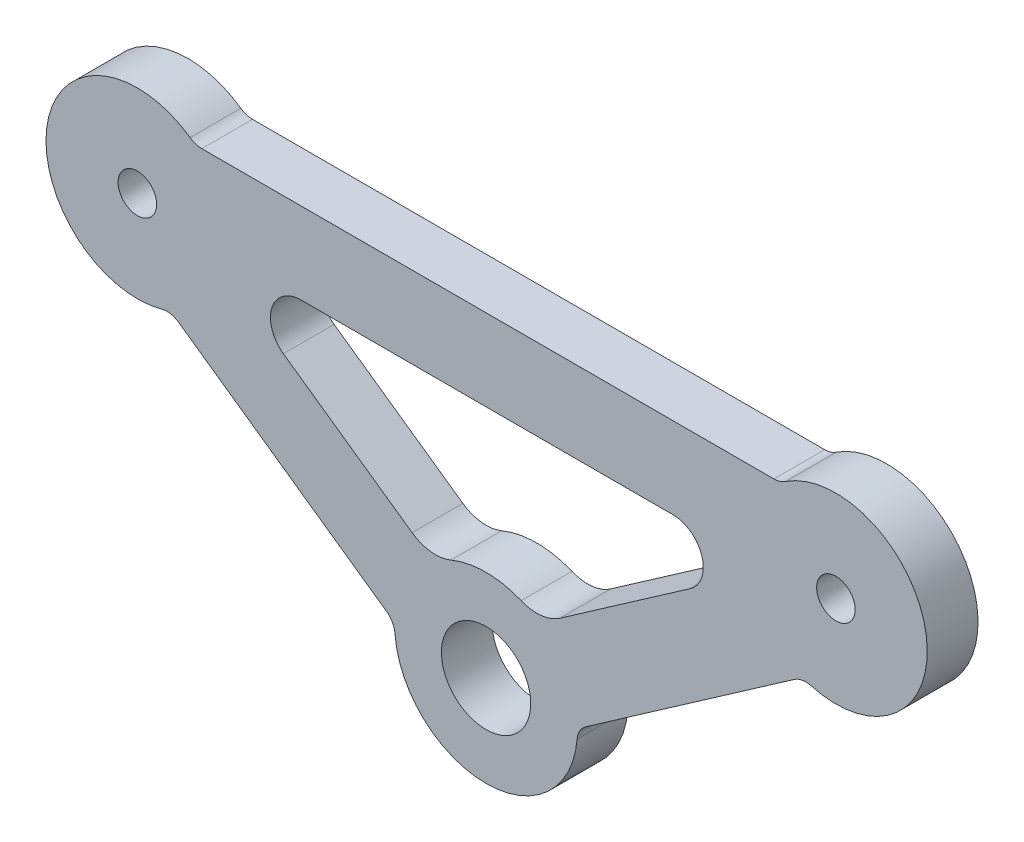
from build123d import *

# Parameters (mm, degrees)
ESQUISSE1_R        = 1.9
ESQUISSE1_R_2      = 4.4
BOSS_EXTRU_1_DEPTH = 5


with BuildPart() as part:
    # Esquisse1 → Boss.-Extru.1 (new body)
    with BuildSketch(Plane.XY):
        with BuildLine():
            Line((30.300082727, 2.968924298), (9.763004104, -11.338457247))
            ThreePointArc((9.763004104, -11.338457247), (9.172405802, -11.982601165), (8.912853429, -12.817083223))
            ThreePointArc((8.912853429, -12.817083223), (-0.078877501, -21.086221809), (-9.031083885, -12.77430994))
            ThreePointArc((-9.031083885, -12.77430994), (-9.286654991, -11.938599972), (-9.874175684, -11.291647751))
            Line((-9.874175684, -11.291647751), (-30.342811787, 3.113479848))
            ThreePointArc((-30.342811787, 3.113479848), (-31.150105491, 3.448150462), (-32.023034153, 3.406640278))
            ThreePointArc((-32.023034153, 3.406640278), (-43.269038369, 13.640318644), (-29.212114116, 19.437185406))
            ThreePointArc((-29.212114116, 19.437185406), (-28.66359268, 19.164598239), (-28.058297671, 19.070803357))
            Line((-28.058297671, 19.070803357), (28.299854, 19.070803357))
            ThreePointArc((28.299854, 19.070803357), (28.91331959, 19.167212023), (29.467641782, 19.447143388))
            ThreePointArc((29.467641782, 19.447143388), (43.297743059, 13.302630265), (31.981683615, 3.25407109))
            ThreePointArc((31.981683615, 3.25407109), (31.108962768, 3.29974241), (30.300082727, 2.968924298))
        make_face()
        with Locations((-34.404288116, 12.085904623)):
            Circle(ESQUISSE1_R, mode=Mode.SUBTRACT)
        with Locations((34.404288116, 11.921884391)):
            Circle(ESQUISSE1_R, mode=Mode.SUBTRACT)
        with Locations((-0.057424101, -12.086247379)):
            Circle(ESQUISSE1_R_2, mode=Mode.SUBTRACT)
        with BuildLine():
            Line((-18.288536611, 11.047420606), (18.173688409, 11.047420606))
            ThreePointArc((18.173688409, 11.047420606), (21.194925395, 8.966949346), (19.94448595, 5.518379385))
            Line((19.94448595, 5.518379385), (7.224114855, -3.343407178))
            ThreePointArc((7.224114855, -3.343407178), (5.36635505, -4.038296984), (3.403177648, -3.755316724))
            ThreePointArc((3.403177648, -3.755316724), (-0.06139684, -3.06515242), (-3.525362111, -3.758367937))
            ThreePointArc((-3.525362111, -3.758367937), (-5.489866285, -4.031985712), (-7.344292156, -3.328247102))
            Line((-7.344292156, -3.328247102), (-20.022270936, 5.59408196))
            ThreePointArc((-20.022270936, 5.59408196), (-21.154680468, 8.956364593), (-18.288536611, 11.047420606))
        make_face(mode=Mode.SUBTRACT)
    extrude(amount=BOSS_EXTRU_1_DEPTH)


solid = part.part
